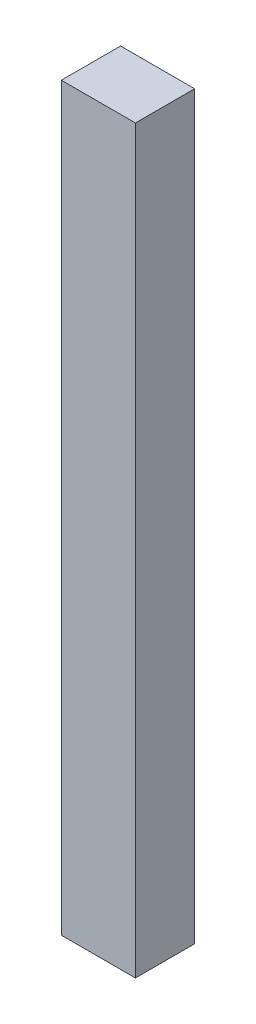
from build123d import *

# Parameters (mm, degrees)
SKETCH1_W           = 12.7
SKETCH1_H           = 10.16
BOSS_EXTRUDE1_DEPTH = 127


with BuildPart() as part:
    # Sketch1 → Boss-Extrude1 (new body)
    with BuildSketch(Plane(origin=(0, 0, 0), x_dir=(1, 0, 0), z_dir=(0, 1, 0))):
        with Locations((6.35, 5.08)):
            Rectangle(SKETCH1_W, SKETCH1_H)
    extrude(amount=BOSS_EXTRUDE1_DEPTH)


solid = part.part
